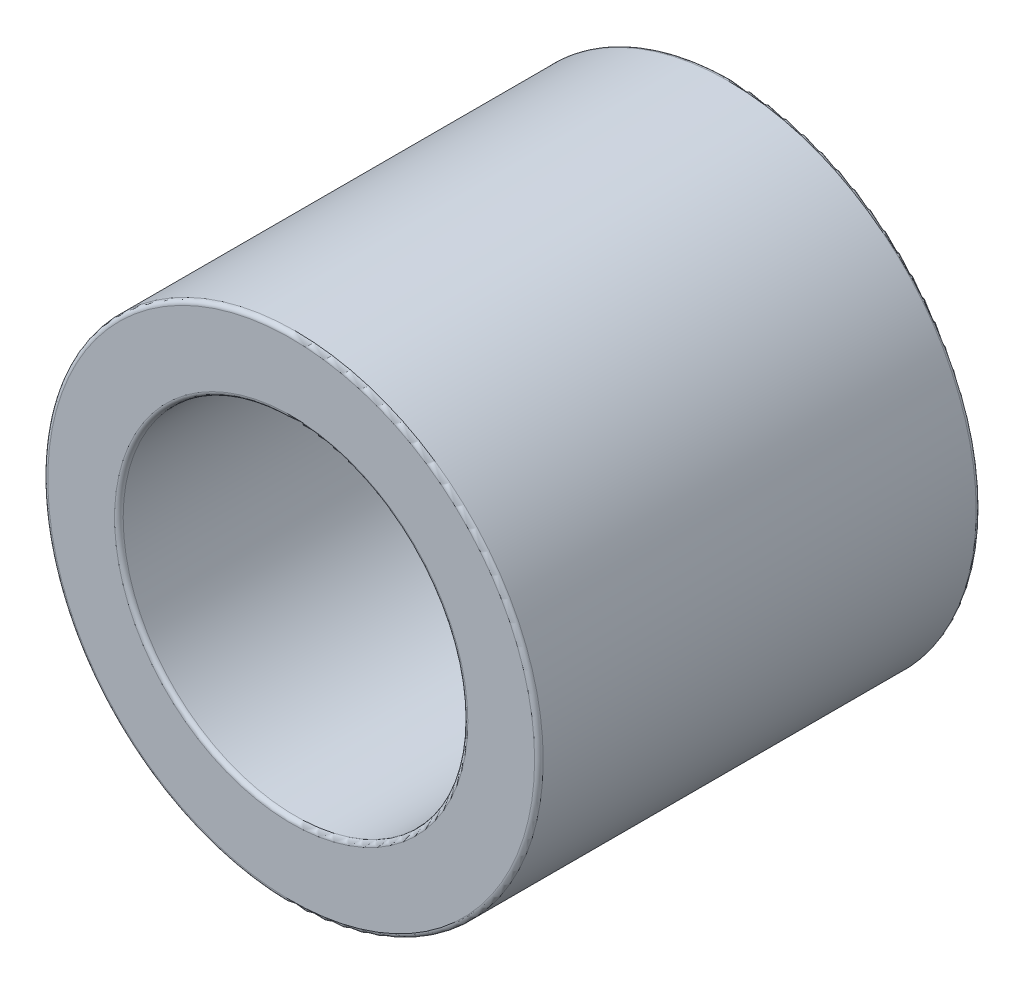
from build123d import *

# Parameters (mm, degrees)
SKETCH1_R           = 5.75
SKETCH1_R_2         = 4
BOSS_EXTRUDE1_DEPTH = 5.125
FILLET1_R           = 0.1


with BuildPart() as part:
    # Sketch1 → Boss-Extrude1 (new, symmetric)
    with BuildSketch(Plane.XY):
        Circle(SKETCH1_R)
        Circle(SKETCH1_R_2, mode=Mode.SUBTRACT)
    extrude(amount=BOSS_EXTRUDE1_DEPTH, both=True)

    # Fillet1
    fillet1_edges = [part.edges().sort_by_distance(p)[0] for p in [
        (-5.75, 0, -5.125),
        (-5.75, 0, 5.125),
        (-4, 0, -5.125),
        (-4, 0, 5.125),
    ]]
    fillet(fillet1_edges, radius=FILLET1_R)


solid = part.part
